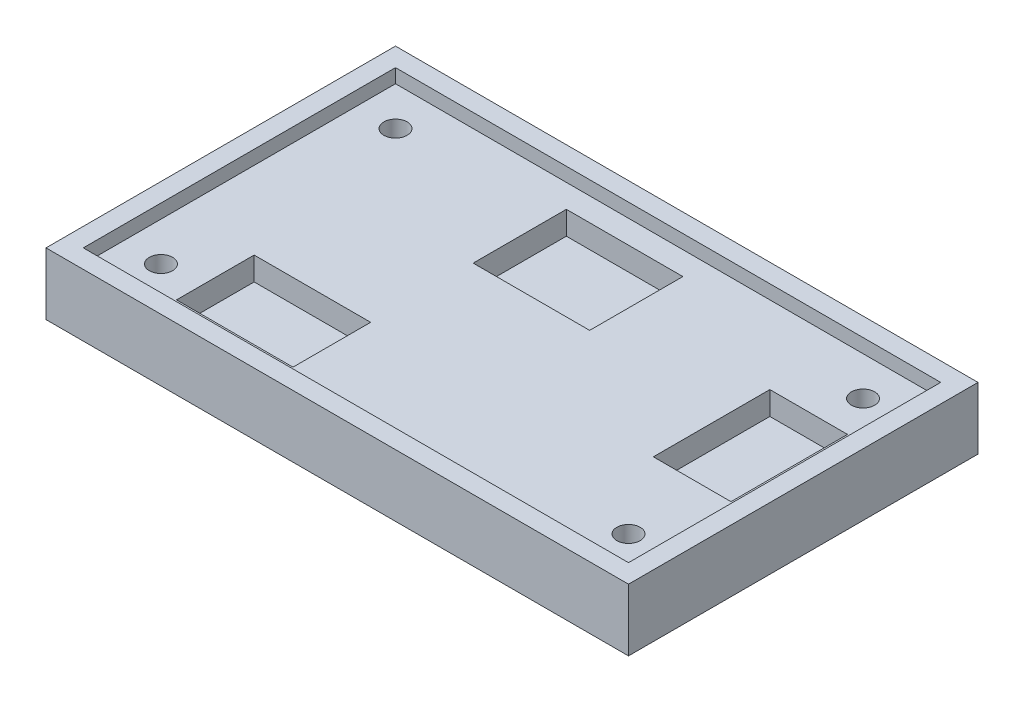
from build123d import *

# Parameters (mm, degrees)
SKETCH_2_W          = 75
SKETCH_2_H          = 45
EXTRUDE_3_DEPTH     = 8
SKETCH_5_W          = 70.2
SKETCH_5_H          = 40.2
CUT_EXTRUDE_1_DEPTH = 1.8
SKETCH_7_R          = 1.5
CUT_EXTRUDE_4_DEPTH = 2.2
SKETCH_8_W          = 15
SKETCH_8_H          = 10
SKETCH_8_W_2        = 10
SKETCH_8_H_2        = 15
SKETCH_8_H_3        = 12
CUT_EXTRUDE_6_DEPTH = 3


with BuildPart() as part:
    # 草图2 → 凸台-拉伸3 (new body)
    with BuildSketch(Plane(origin=(0, 0, 0), x_dir=(1, 0, 0), z_dir=(0, 1, 0))):
        with Locations((37.5, 22.5)):
            Rectangle(SKETCH_2_W, SKETCH_2_H)
    extrude(amount=EXTRUDE_3_DEPTH)

    # 草图5 → 切除-拉伸1 (cut)
    with BuildSketch(Plane(origin=(0, 8, 0), x_dir=(1, 0, 0), z_dir=(0, 1, 0))):
        with Locations((37.5, 22.5)):
            Rectangle(SKETCH_5_W, SKETCH_5_H)
    extrude(amount=-CUT_EXTRUDE_1_DEPTH, mode=Mode.SUBTRACT)

    # 草图7 → 切除-拉伸4 (cut)
    with BuildSketch(Plane(origin=(0, 6.2, 0), x_dir=(1, 0, 0), z_dir=(0, 1, 0))):
        with Locations(Location((7.4, 37.6, 0), (0, 0, 270))):
            Circle(SKETCH_7_R)
        with Locations(Location((67.6, 37.6, 0), (0, 0, 90))):
            Circle(SKETCH_7_R)
        with Locations(Location((7.4, 7.4, 0), (0, 0, 90))):
            Circle(SKETCH_7_R)
        with Locations(Location((67.6, 7.4, 0), (0, 0, 270))):
            Circle(SKETCH_7_R)
    extrude(amount=-CUT_EXTRUDE_4_DEPTH, mode=Mode.SUBTRACT)

    # 草图8 → 切除-拉伸6 (cut)
    with BuildSketch(Plane(origin=(0, 6.2, 0), x_dir=(1, 0, 0), z_dir=(0, 1, 0))):
        with Locations((19.9, 9.4)):
            Rectangle(SKETCH_8_W, SKETCH_8_H)
        with Locations((65.6, 25.1)):
            Rectangle(SKETCH_8_W_2, SKETCH_8_H_2)
        with Locations((34.9, 33.6)):
            Rectangle(SKETCH_8_W, SKETCH_8_H_3)
    extrude(amount=-CUT_EXTRUDE_6_DEPTH, mode=Mode.SUBTRACT)


solid = part.part
